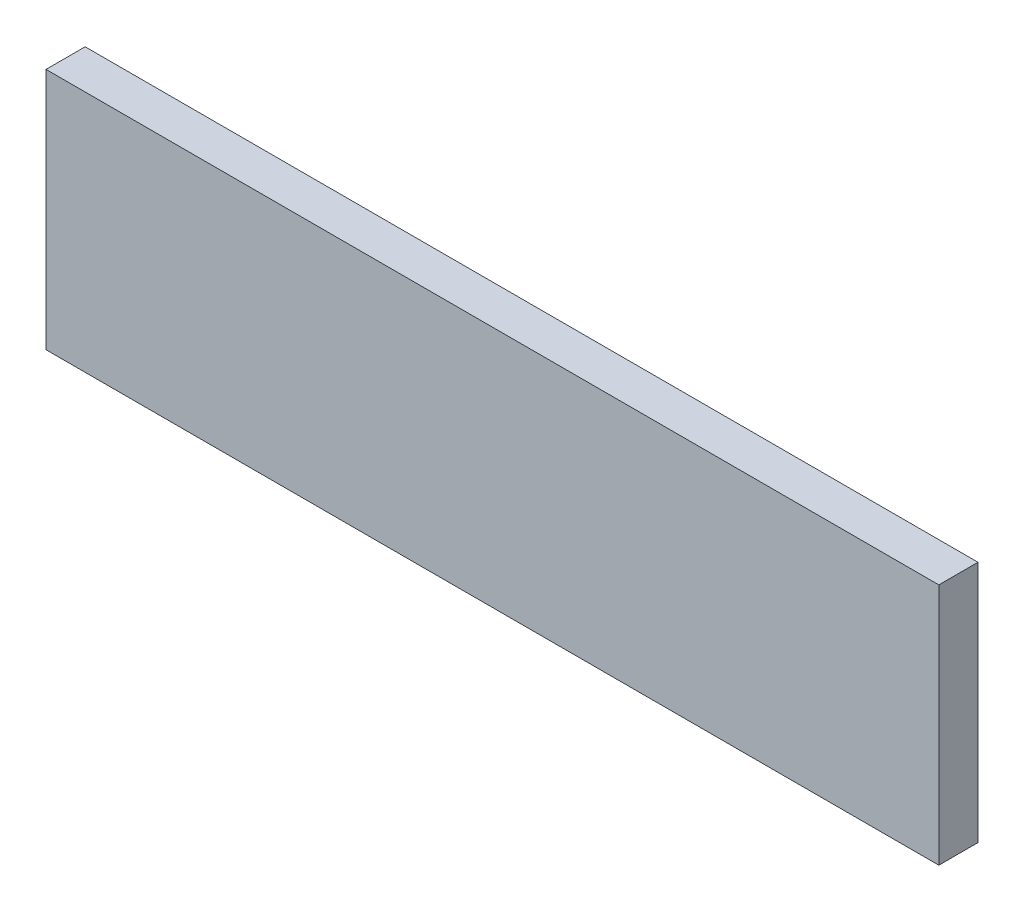
from build123d import *

# Parameters (mm, degrees)
SKETCH1_W           = 228
SKETCH1_H           = 62
BOSS_EXTRUDE1_DEPTH = 10


with BuildPart() as part:
    # Sketch1 → Boss-Extrude1 (new body)
    with BuildSketch(Plane.XY):
        with Locations((114, 31)):
            Rectangle(SKETCH1_W, SKETCH1_H)
    extrude(amount=BOSS_EXTRUDE1_DEPTH)


solid = part.part
